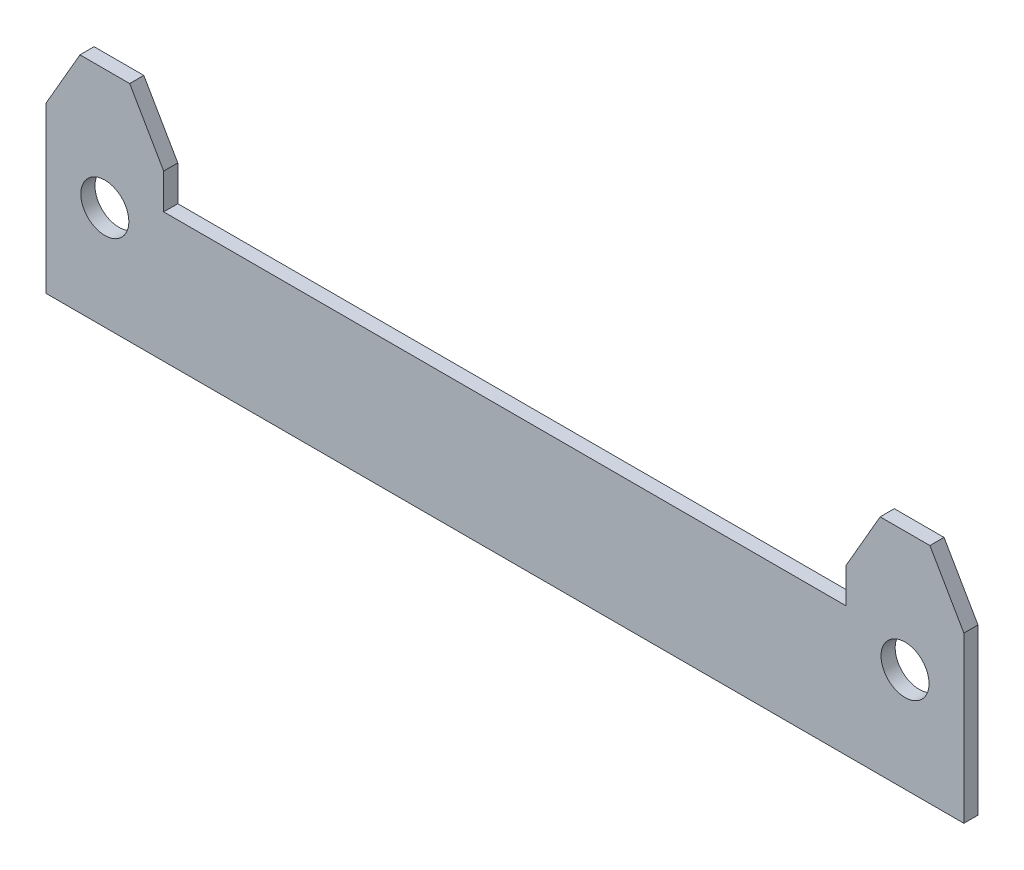
from build123d import *

# Parameters (mm, degrees)
SZKIC1_R                    = 5.1
DODANIE_WYCI_GNI_CIE1_DEPTH = 3


with BuildPart() as part:
    # Szkic1 → Dodanie-wyciągnięcie1 (new body)
    with BuildSketch(Plane.XY):
        Polygon((97.5, 0), (-97.5, 0), (-97.5, 35), (-90.283121635, 47.5), (-79.716878365, 47.5), (-72.5, 35), (-72.5, 27.5), (72.5, 27.5), (72.5, 35), (79.716878365, 47.5), (90.283121635, 47.5), (97.5, 35), align=None)
        with Locations((-85, 22)):
            Circle(SZKIC1_R, mode=Mode.SUBTRACT)
        with Locations(Location((85, 22, 0), (0, 0, 180))):
            Circle(SZKIC1_R, mode=Mode.SUBTRACT)
    extrude(amount=DODANIE_WYCI_GNI_CIE1_DEPTH)


solid = part.part
